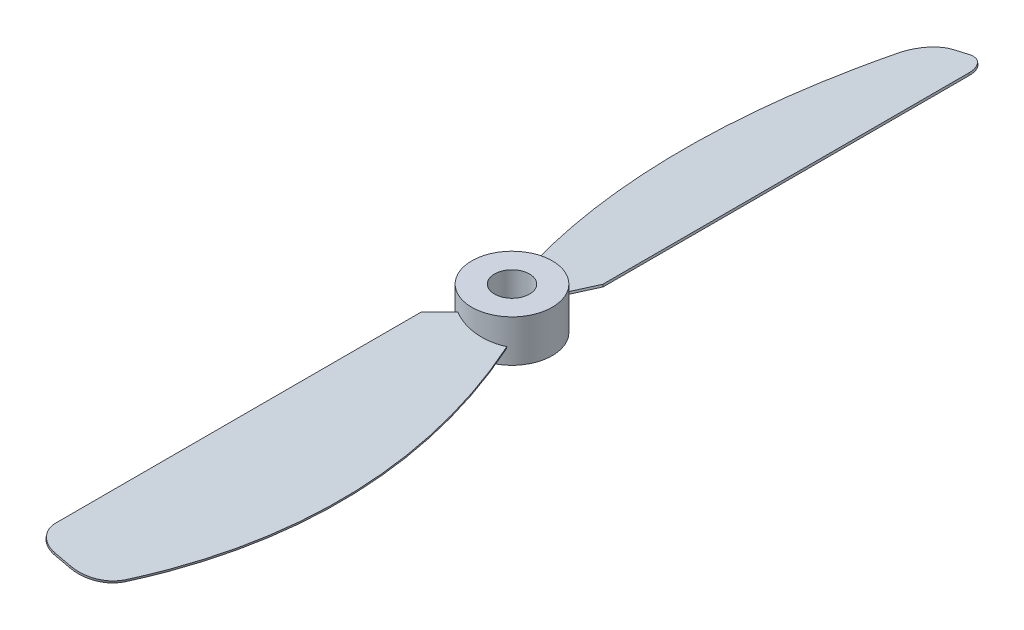
from build123d import *

# Parameters (mm, degrees)
SKETCH1_R           = 5.75
BOSS_EXTRUDE1_DEPTH = 3
BOSS_EXTRUDE2_DEPTH = 0.15
CIRPATTERN1_COUNT   = 2
SKETCH5_R           = 2.5
CUT_EXTRUDE1_DEPTH  = 65.479328162
CHAMFER1_SIZE       = 1


with BuildPart() as part:
    # Sketch1 → Boss-Extrude1 (new, symmetric)
    with BuildSketch(Plane(origin=(0, 0, 0), x_dir=(1, 0, 0), z_dir=(0, 1, 0))):
        with Locations(Location((0, 0, 0), (0, 0, 270))):
            Circle(SKETCH1_R)
    extrude(amount=BOSS_EXTRUDE1_DEPTH, both=True)

    # Sketch4 → Boss-Extrude2 (add, symmetric)
    with BuildSketch(Plane(origin=(0, 0, 0), x_dir=(0.9743700647852352, -0.22495105434386534, 0), z_dir=(-0.2249510543438653, -0.9743700647852351, 0))):
        with BuildLine():
            Line((-2.09695858, 4.179050657), (-4.927774709, 8.201975805))
            Line((-4.927774709, 8.201975805), (-4.927774709, 60.5))
            ThreePointArc((-4.927774709, 60.5), (-4.049095053, 62.621320344), (-1.927774709, 63.5))
            Line((-1.927774709, 63.5), (0.385917788, 63.5))
            ThreePointArc((0.385917788, 63.5), (3.272130568, 62.582863675), (5.099523115, 60.167910314))
            add(Edge.make_bspline(
                [(3.648123834, 4.179050657), (11.246463355, 22.537150452), (11.557411768, 41.917565493), (5.099523115, 60.167910314)],
                knots=[0, 0, 0, 0, 0.942591792, 0.942591792, 0.942591792, 0.942591792], degree=3))
            Line((3.648123834, 4.179050657), (-2.09695858, 4.179050657))
        make_face()
    boss_extrude2 = extrude(amount=BOSS_EXTRUDE2_DEPTH, both=True)

    # CirPattern1: Boss-Extrude2 ×2 about axis
    cirpattern1_axis = Axis((0, -3, 0), (0, 1, 0))
    for i in range(1, CIRPATTERN1_COUNT):
        add(boss_extrude2.rotate(cirpattern1_axis, i * 360 / CIRPATTERN1_COUNT))

    # Sketch5 → Cut-Extrude1 (cut, through all)
    with BuildSketch(Plane.XZ.offset(3)):
        with Locations(Location((0, 0, 0), (0, 0, 270))):
            Circle(SKETCH5_R)
    extrude(amount=-CUT_EXTRUDE1_DEPTH, mode=Mode.SUBTRACT)

    # Chamfer1
    chamfer1_edges = [part.edges().sort_by_distance(p)[0] for p in [
        (0, -3, 2.5),
    ]]
    chamfer(chamfer1_edges, length=CHAMFER1_SIZE)


solid = part.part
